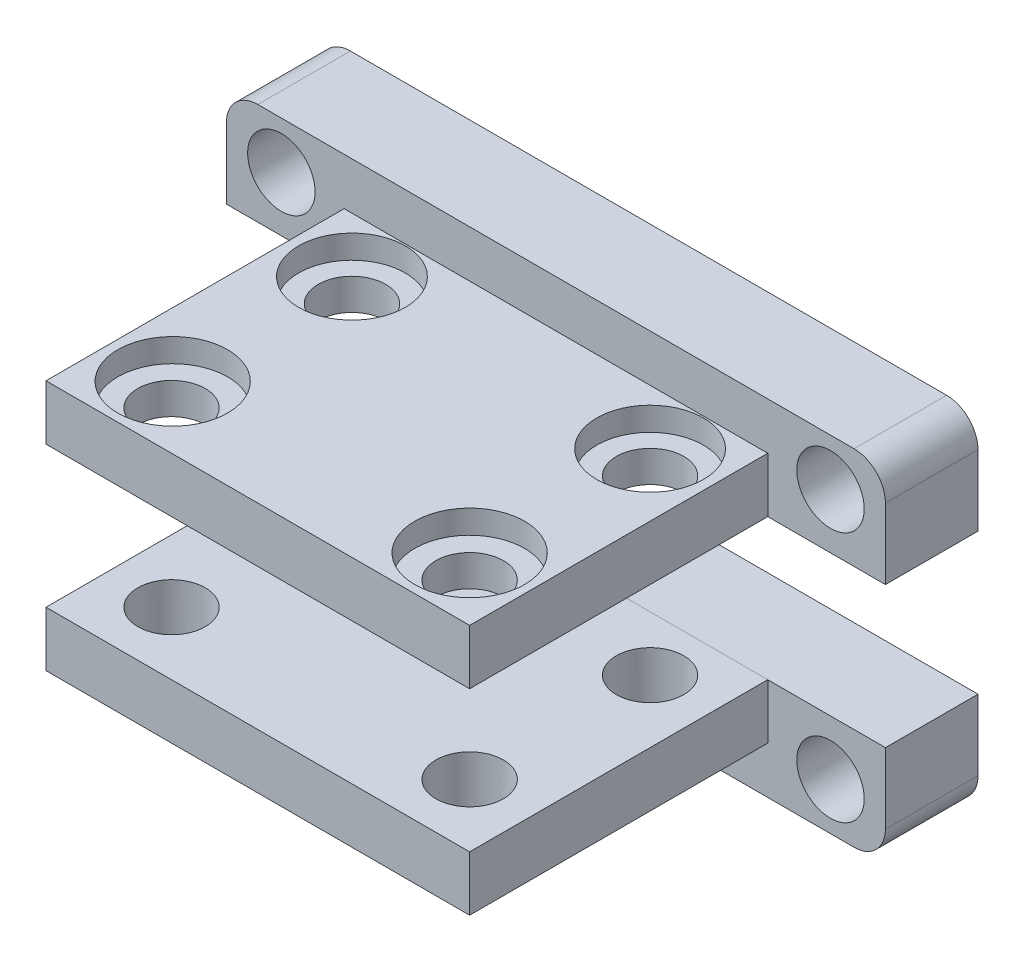
from build123d import *

# Parameters (mm, degrees)
SKETCH_1_W           = 42
SKETCH_1_H           = 22
EXTRUDE_1_DEPTH      = 5.9
FILLET_1_R           = 2
SKETCH_2_R           = 2.15
CUT_EXTRUDE_1_DEPTH  = 10
EXTRUDE_2_DEPTH      = 19
SKETCH_4_W           = 42
SKETCH_4_H           = 9
CUT_EXTRUDE_6_DEPTH  = 24.9
SKETCH_6_W           = 19
SKETCH_6_H           = 3
CUT_EXTRUDE_7_DEPTH  = 27
SKETCH_7_R           = 2.15
CUT_EXTRUDE_8_DEPTH  = 50
SKETCH_8_R           = 3.4
SKETCH_8_R_2         = 3.5
CUT_EXTRUDE_11_DEPTH = 1.5


with BuildPart() as part:
    # 草图1 → 凸台-拉伸1 (new body)
    with BuildSketch(Plane.XY):
        Rectangle(SKETCH_1_W, SKETCH_1_H)
    extrude(amount=EXTRUDE_1_DEPTH)

    # 圆角1
    fillet_1_edges = [part.edges().sort_by_distance(p)[0] for p in [
        (21, -11, 2.95),
        (-21, -11, 2.95),
        (-21, 11, 2.95),
        (21, 11, 2.95),
    ]]
    fillet(fillet_1_edges, radius=FILLET_1_R)

    # 草图2 → 切除-拉伸1 (cut)
    with BuildSketch(Plane.XY.offset(5.9)):
        with Locations((17.5, 8)):
            Circle(SKETCH_2_R)
        with Locations((-17.5, 8)):
            Circle(SKETCH_2_R)
        with Locations((17.5, -8)):
            Circle(SKETCH_2_R)
        with Locations((-17.5, -8)):
            Circle(SKETCH_2_R)
    extrude(amount=-CUT_EXTRUDE_1_DEPTH, mode=Mode.SUBTRACT)


with BuildPart() as body_2:
    # 草图3 → 凸台-拉伸2 (new body)
    with BuildSketch(Plane(origin=(0, 0, 24.9), x_dir=(-1, 0, 0), z_dir=(0, 0, -1))):
        Polygon((-21, -4.5), (-21, 4.5), (-13.5, 4.5), (-13.5, 11), (13.5, 11), (13.5, 4.5), (21, 4.5), (21, -4.5), (13.5, -4.5), (13.5, -11), (-13.5, -11), (-13.5, -4.5), align=None)
    extrude(amount=EXTRUDE_2_DEPTH)


with BuildPart() as cut_extrude_6_tool:
    # 草图4 → 切除-拉伸6 (new body)
    with BuildSketch(Plane.XY.offset(24.9)):
        Rectangle(SKETCH_4_W, SKETCH_4_H)
    extrude(amount=-CUT_EXTRUDE_6_DEPTH)


with BuildPart() as part_1:
    add(part.part)

    # 切除-拉伸6: cut by cut_extrude_6_tool
    add(cut_extrude_6_tool.part, mode=Mode.SUBTRACT)


with BuildPart() as body_2_1:
    add(body_2.part)

    # 切除-拉伸6: cut by cut_extrude_6_tool
    add(cut_extrude_6_tool.part, mode=Mode.SUBTRACT)


with BuildPart() as cut_extrude_6_piece_1:
    # of the separate pieces the step leaves, piece 1, a body of its own (cut_extrude_6_pieces)
    add(part_1.part.solids().sort_by_distance((-19, 11, 0))[0])


with BuildPart() as cut_extrude_6_piece_2:
    # of the separate pieces the step leaves, piece 2, a body of its own (cut_extrude_6_pieces)
    add(part_1.part.solids().sort_by_distance((-21, -9, 0))[0])


with BuildPart() as cut_extrude_6_piece_1_of_body_2:
    # of the separate pieces the step leaves, piece 1, a body of its own (cut_extrude_6_pieces_of_body_2)
    add(body_2_1.part.solids().sort_by_distance((13.5, 4.5, 24.9))[0])


with BuildPart() as cut_extrude_6_piece_2_of_body_2:
    # of the separate pieces the step leaves, piece 2, a body of its own (cut_extrude_6_pieces_of_body_2)
    add(body_2_1.part.solids().sort_by_distance((13.5, -11, 24.9))[0])


with BuildPart() as cut_extrude_7_tool:
    # 草图6 → 切除-拉伸7 (new body)
    with BuildSketch(Plane(origin=(13.5, 0, 0), x_dir=(0, 0, -1), z_dir=(1, 0, 0))):
        with Locations((-15.4, 9.5)):
            Rectangle(SKETCH_6_W, SKETCH_6_H)
        with Locations((-15.4, -9.5)):
            Rectangle(SKETCH_6_W, SKETCH_6_H)
    extrude(amount=-CUT_EXTRUDE_7_DEPTH)


with BuildPart() as cut_extrude_6_piece_1_of_body_2_1:
    add(cut_extrude_6_piece_1_of_body_2.part)

    # 切除-拉伸7: cut by cut_extrude_7_tool
    add(cut_extrude_7_tool.part, mode=Mode.SUBTRACT)


with BuildPart() as cut_extrude_6_piece_2_of_body_2_1:
    add(cut_extrude_6_piece_2_of_body_2.part)

    # 切除-拉伸7: cut by cut_extrude_7_tool
    add(cut_extrude_7_tool.part, mode=Mode.SUBTRACT)


with BuildPart() as cut_extrude_8_tool:
    # 草图7 → 切除-拉伸8 (new body)
    with BuildSketch(Plane(origin=(0, 8, 0), x_dir=(1, 0, 0), z_dir=(0, 1, 0))):
        with Locations(Location((-9.5, -9.4, 0), (0, 0, 270))):
            Circle(SKETCH_7_R)
        with Locations(Location((9.5, -9.4, 0), (0, 0, 270))):
            Circle(SKETCH_7_R)
        with Locations(Location((-9.5, -20.9, 0), (0, 0, 270))):
            Circle(SKETCH_7_R)
        with Locations(Location((9.5, -20.9, 0), (0, 0, 270))):
            Circle(SKETCH_7_R)
    extrude(amount=-CUT_EXTRUDE_8_DEPTH)


with BuildPart() as cut_extrude_6_piece_1_of_body_2_2:
    add(cut_extrude_6_piece_1_of_body_2_1.part)

    # 切除-拉伸8: cut by cut_extrude_8_tool
    add(cut_extrude_8_tool.part, mode=Mode.SUBTRACT)

    # 草图8 → 切除-拉伸11 (cut)
    with BuildSketch(Plane(origin=(0, 8, 0), x_dir=(1, 0, 0), z_dir=(0, 1, 0))):
        with Locations(Location((-9.5, -9.4, 0), (0, 0, 270))):
            Circle(SKETCH_8_R)
        with Locations(Location((9.5, -9.4, 0), (0, 0, 270))):
            Circle(SKETCH_8_R)
        with Locations(Location((-9.430716155, -20.89534369, 0), (0, 0, 270))):
            Circle(SKETCH_8_R_2)
        with Locations(Location((9.5, -20.9, 0), (0, 0, 270))):
            Circle(SKETCH_8_R_2)
    extrude(amount=-CUT_EXTRUDE_11_DEPTH, mode=Mode.SUBTRACT)


with BuildPart() as cut_extrude_6_piece_2_of_body_2_2:
    add(cut_extrude_6_piece_2_of_body_2_1.part)

    # 切除-拉伸8: cut by cut_extrude_8_tool
    add(cut_extrude_8_tool.part, mode=Mode.SUBTRACT)


solid = Compound([cut_extrude_6_piece_1.part, cut_extrude_6_piece_2.part, cut_extrude_6_piece_1_of_body_2_2.part, cut_extrude_6_piece_2_of_body_2_2.part])
